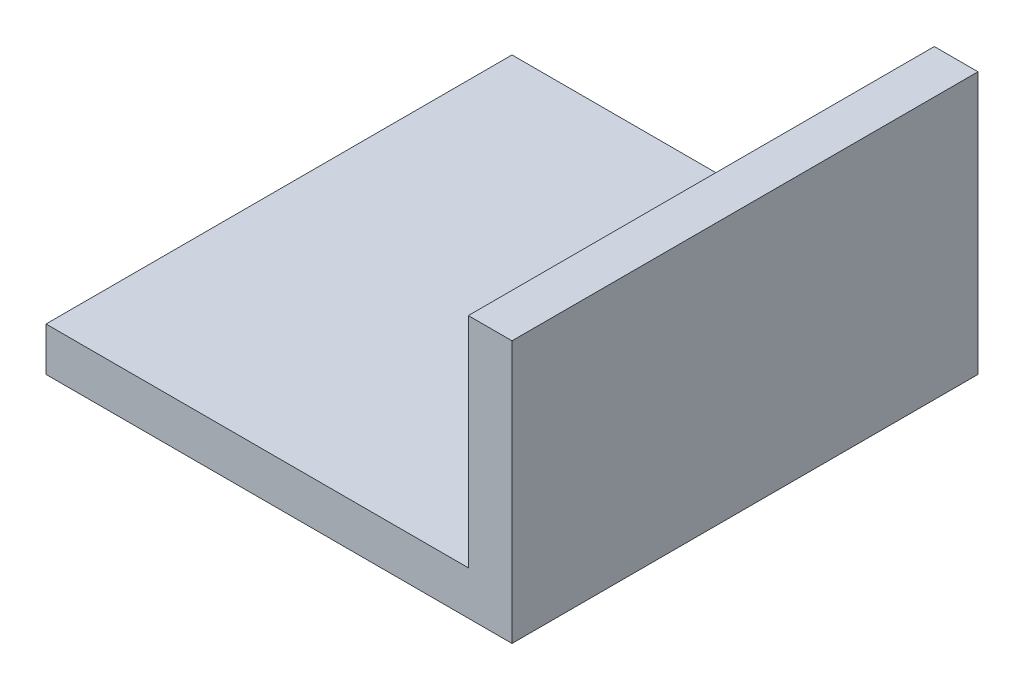
from build123d import *

# Parameters (mm, degrees)
BOSS_EXTRUDE1_DEPTH = 50.8


with BuildPart() as part:
    # Sketch3 → Boss-Extrude1 (new body)
    with BuildSketch(Plane.XY):
        Polygon((-20.153543524, 2.352669395), (-20.153543524, 30.927669395), (-24.916043524, 30.927669395), (-24.916043524, 7.115169395), (-70.953543524, 7.115169395), (-70.953543524, 2.352669395), align=None)
    extrude(amount=BOSS_EXTRUDE1_DEPTH)


solid = part.part
